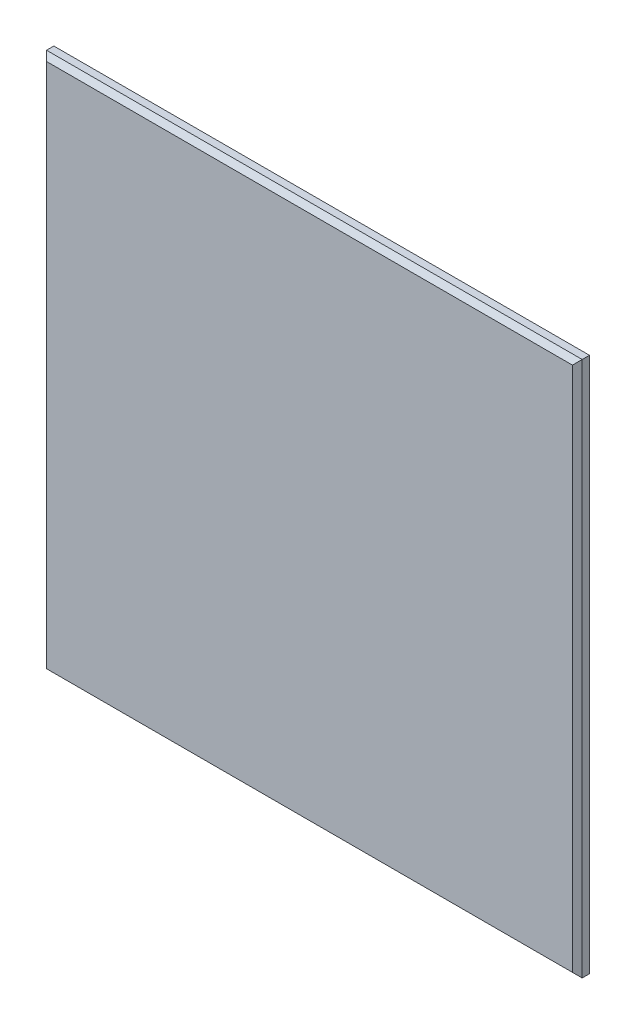
from build123d import *

# Parameters (mm, degrees)
SKETCH1_W           = 220
SKETCH1_H           = 220
BOSS_EXTRUDE1_DEPTH = 5
CHAMFER1_SIZE       = 2


with BuildPart() as part:
    # Sketch1 → Boss-Extrude1 (new body)
    with BuildSketch(Plane.XY):
        Rectangle(SKETCH1_W, SKETCH1_H)
    extrude(amount=BOSS_EXTRUDE1_DEPTH)

    # Chamfer1
    chamfer1_edges = [part.edges().sort_by_distance(p)[0] for p in [
        (-110, 0, 5),
        (0, -110, 5),
        (110, 0, 5),
        (0, 110, 5),
    ]]
    chamfer(chamfer1_edges, length=CHAMFER1_SIZE)


solid = part.part
